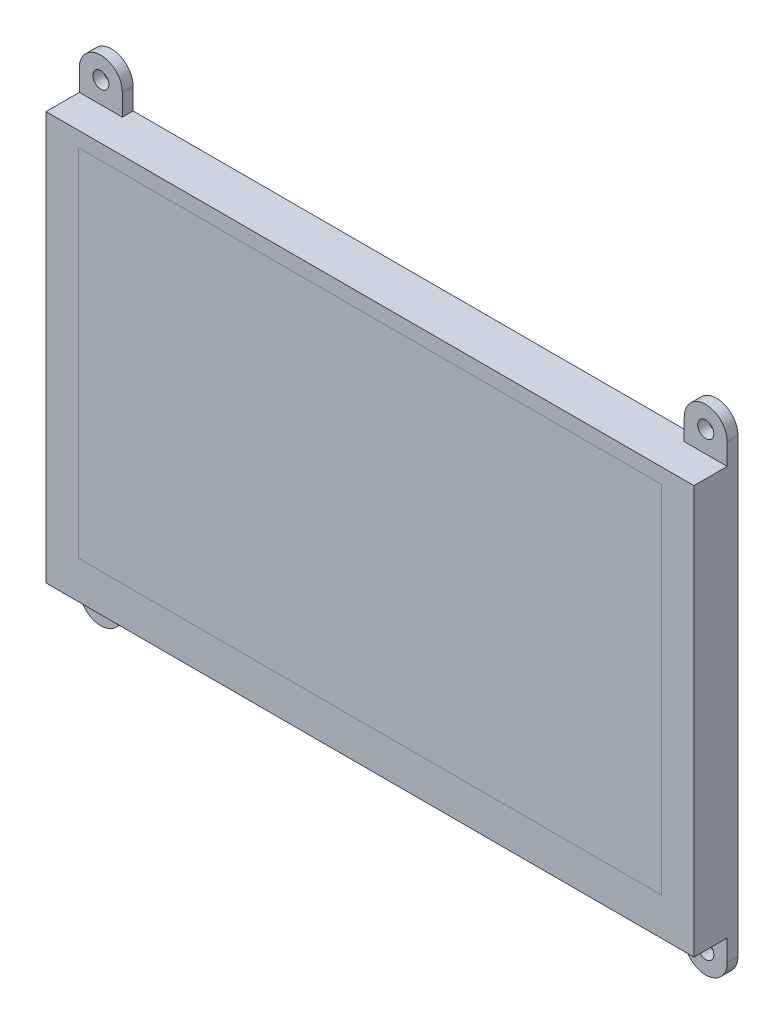
from build123d import *

# Parameters (mm, degrees)
SKETCH1_R           = 4
SKETCH1_R_2         = 1.5
SKETCH1_W           = 120.6
SKETCH1_H           = 76
BOSS_EXTRUDE1_DEPTH = 2
SKETCH4_W           = 120.6
SKETCH4_H           = 76
BOSS_EXTRUDE3_DEPTH = 6.2


with BuildPart() as part:
    # Sketch1 → Boss-Extrude1 (new body)
    # profile 1 of 13: a face of its own
    with BuildSketch(Plane.XY):
        with Locations((-56.3, 42)):
            Circle(SKETCH1_R)
        with Locations((-56.3, 42)):
            Circle(SKETCH1_R_2, mode=Mode.SUBTRACT)
    # profile 2 of 13: a face of its own
    with BuildSketch(Plane.XY):
        with BuildLine():
            Line((-60.3, 42), (-60.3, 38))
            Line((-60.3, 38), (-56.3, 38))
            ThreePointArc((-56.3, 38), (-59.128427125, 39.171572875), (-60.3, 42))
        make_face()
    # profile 3 of 13: a face of its own
    with BuildSketch(Plane.XY):
        with BuildLine():
            ThreePointArc((-52.3, 42), (-53.471572875, 39.171572875), (-56.3, 38))
            Line((-56.3, 38), (-52.3, 38))
            Line((-52.3, 38), (-52.3, 42))
        make_face()
    # profile 4 of 13: a face of its own
    with BuildSketch(Plane.XY):
        Rectangle(SKETCH1_W, SKETCH1_H)
    # profile 5 of 13: a face of its own
    with BuildSketch(Plane.XY):
        with BuildLine():
            ThreePointArc((60.3, 42), (59.128427107, 39.171572857), (56.299999949, 38))
            Line((56.299999949, 38), (60.3, 38))
            Line((60.3, 38), (60.3, 42))
        make_face()
    # profile 6 of 13: a face of its own
    with BuildSketch(Plane.XY):
        with Locations((56.3, 42)):
            Circle(SKETCH1_R)
        with Locations((56.3, 42)):
            Circle(SKETCH1_R_2, mode=Mode.SUBTRACT)
    # profile 7 of 13: a face of its own
    with BuildSketch(Plane.XY):
        with BuildLine():
            Line((52.3, 42), (52.3, 38))
            Line((52.3, 38), (56.299999949, 38))
            ThreePointArc((56.299999949, 38), (53.471572857, 39.171572893), (52.3, 42))
        make_face()
    # profile 8 of 13: a face of its own
    with BuildSketch(Plane.XY):
        with BuildLine():
            Line((-52.3, -38), (-56.3, -38))
            ThreePointArc((-56.3, -38), (-53.471572875, -39.171572875), (-52.3, -42))
            Line((-52.3, -42), (-52.3, -38))
        make_face()
    # profile 9 of 13: a face of its own
    with BuildSketch(Plane.XY):
        with BuildLine():
            Line((-56.3, -38), (-60.3, -38))
            Line((-60.3, -38), (-60.3, -42))
            ThreePointArc((-60.3, -42), (-59.128427125, -39.171572875), (-56.3, -38))
        make_face()
    # profile 10 of 13: a face of its own
    with BuildSketch(Plane.XY):
        with Locations((-56.3, -42)):
            Circle(SKETCH1_R)
        with Locations((-56.3, -42)):
            Circle(SKETCH1_R_2, mode=Mode.SUBTRACT)
    # profile 11 of 13: a face of its own
    with BuildSketch(Plane.XY):
        with BuildLine():
            Line((56.3, -38), (52.3, -38))
            Line((52.3, -38), (52.3, -42))
            ThreePointArc((52.3, -42), (53.471572875, -39.171572875), (56.3, -38))
        make_face()
    # profile 12 of 13: a face of its own
    with BuildSketch(Plane.XY):
        with Locations((56.3, -42)):
            Circle(SKETCH1_R)
        with Locations((56.3, -42)):
            Circle(SKETCH1_R_2, mode=Mode.SUBTRACT)
    # profile 13 of 13: a face of its own
    with BuildSketch(Plane.XY):
        with BuildLine():
            Line((60.3, -38), (56.3, -38))
            ThreePointArc((56.3, -38), (59.128427125, -39.171572875), (60.3, -42))
            Line((60.3, -42), (60.3, -38))
        make_face()
    extrude(amount=BOSS_EXTRUDE1_DEPTH)

    # Sketch4 → Boss-Extrude3 (add)
    with BuildSketch(Plane.XY.offset(2)):
        Rectangle(SKETCH4_W, SKETCH4_H)
    extrude(amount=BOSS_EXTRUDE3_DEPTH)


solid = part.part
